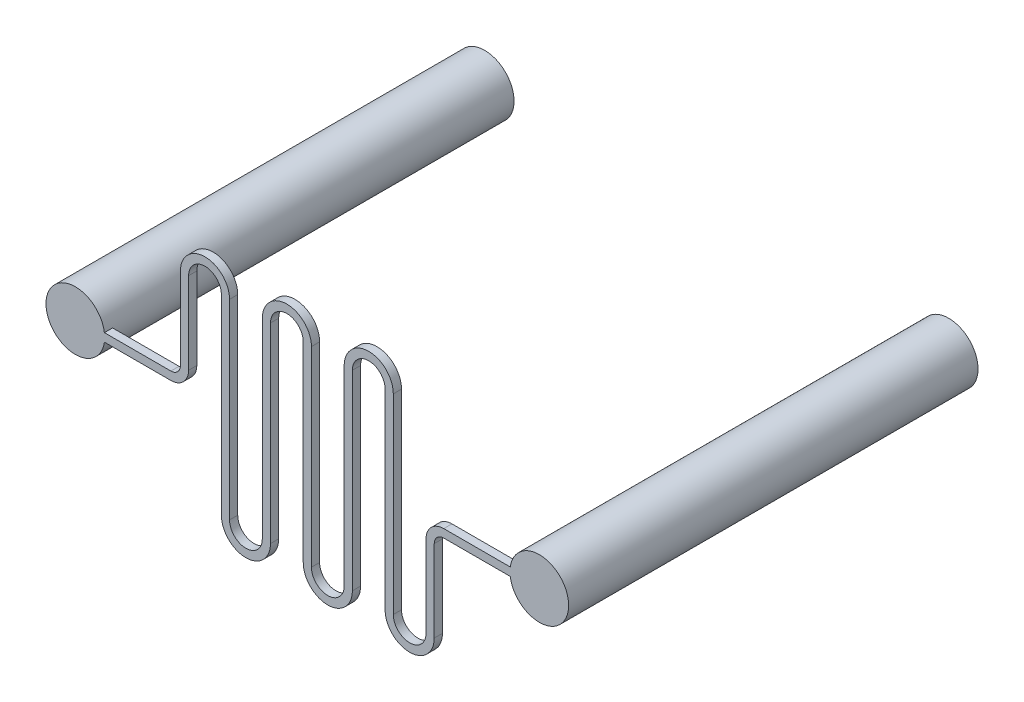
from build123d import *

# Parameters (mm, degrees)
BOSS_EXTRUDE1_DEPTH = 0.6
SKETCH3_W           = 2.15
SKETCH3_H           = 30
SKETCH4_W           = 2.15
SKETCH4_H           = 30
SKETCH5_R           = 1.75
CUT_EXTRUDE1_DEPTH  = 29


with BuildPart() as part:
    # Sketch2 → Boss-Extrude1 (new body)
    with BuildSketch(Plane.XY):
        with BuildLine():
            Line((-20.5, -0.3), (-13.5, -0.3))
            ThreePointArc((-13.5, -0.3), (-12.580761184, 0.080761184), (-12.2, 1))
            Line((-12.2, 1), (-12.2, 7))
            ThreePointArc((-12.2, 7), (-11, 8.2), (-9.8, 7))
            Line((-9.8, 7), (-9.8, 0))
            Line((-9.8, 0), (-9.8, -7))
            ThreePointArc((-9.8, -7), (-8, -8.8), (-6.2, -7))
            Line((-6.2, -7), (-6.2, 0))
            Line((-6.2, 0), (-6.2, 7))
            ThreePointArc((-6.2, 7), (-5, 8.2), (-3.8, 7))
            Line((-3.8, 7), (-3.8, 0))
            Line((-3.8, 0), (-3.8, -7))
            ThreePointArc((-3.8, -7), (-2, -8.8), (-0.2, -7))
            Line((-0.2, -7), (-0.2, 0))
            Line((-0.2, 0), (-0.2, 7))
            ThreePointArc((-0.2, 7), (1, 8.2), (2.2, 7))
            Line((2.2, 7), (2.2, 0))
            Line((2.2, 0), (2.2, -7))
            ThreePointArc((2.2, -7), (4, -8.8), (5.8, -7))
            Line((5.8, -7), (5.8, -1))
            ThreePointArc((5.8, -1), (6.005025253, -0.505025253), (6.5, -0.3))
            Line((6.5, -0.3), (13.5, -0.3))
            ThreePointArc((13.5, -0.3), (13.8, 0), (13.5, 0.3))
            Line((13.5, 0.3), (6.5, 0.3))
            ThreePointArc((6.5, 0.3), (5.580761184, -0.080761184), (5.2, -1))
            Line((5.2, -1), (5.2, -7))
            ThreePointArc((5.2, -7), (4, -8.2), (2.8, -7))
            Line((2.8, -7), (2.8, 0))
            Line((2.8, 0), (2.8, 7))
            ThreePointArc((2.8, 7), (1, 8.8), (-0.8, 7))
            Line((-0.8, 7), (-0.8, 0))
            Line((-0.8, 0), (-0.8, -7))
            ThreePointArc((-0.8, -7), (-2, -8.2), (-3.2, -7))
            Line((-3.2, -7), (-3.2, 0))
            Line((-3.2, 0), (-3.2, 7))
            ThreePointArc((-3.2, 7), (-5, 8.8), (-6.8, 7))
            Line((-6.8, 7), (-6.8, 0))
            Line((-6.8, 0), (-6.8, -7))
            ThreePointArc((-6.8, -7), (-8, -8.2), (-9.2, -7))
            Line((-9.2, -7), (-9.2, 0))
            Line((-9.2, 0), (-9.2, 7))
            ThreePointArc((-9.2, 7), (-11, 8.8), (-12.8, 7))
            Line((-12.8, 7), (-12.8, 1))
            ThreePointArc((-12.8, 1), (-13.005025253, 0.505025253), (-13.5, 0.3))
            Line((-13.5, 0.3), (-20.5, 0.3))
            ThreePointArc((-20.5, 0.3), (-20.8, 0), (-20.5, -0.3))
        make_face()
    extrude(amount=BOSS_EXTRUDE1_DEPTH)

    # Sketch3 → Revolve1 (revolve)
    with BuildSketch(Plane(origin=(0, 0, 0), x_dir=(1, 0, 0), z_dir=(0, 1, 0))):
        with Locations((-21.575, 14.4)):
            Rectangle(SKETCH3_W, SKETCH3_H)
    revolve(axis=Axis((-20.5, 0, -29.4), (0, 0, 1)))

    # Sketch4 → Revolve2 (revolve)
    with BuildSketch(Plane(origin=(0, 0, 0), x_dir=(1, 0, 0), z_dir=(0, 1, 0)), mode=Mode.PRIVATE) as revolve2_sk:
        with Locations((14.575, 14.4)):
            Rectangle(SKETCH4_W, SKETCH4_H)
    revolve(revolve2_sk.sketch.rotate(Axis((13.5, 0, -29.4), (0, 0, 1)), 180), axis=Axis((13.5, 0, -29.4), (0, 0, 1)))

    # Sketch5 → Cut-Extrude1 (cut)
    with BuildSketch(Plane(origin=(0, 0, -29.4), x_dir=(-1, 0, 0), z_dir=(0, 0, -1))):
        with Locations((20.5, 0)):
            Circle(SKETCH5_R)
        with Locations((-13.5, 0)):
            Circle(SKETCH5_R)
    extrude(amount=-CUT_EXTRUDE1_DEPTH, mode=Mode.SUBTRACT)


solid = part.part
